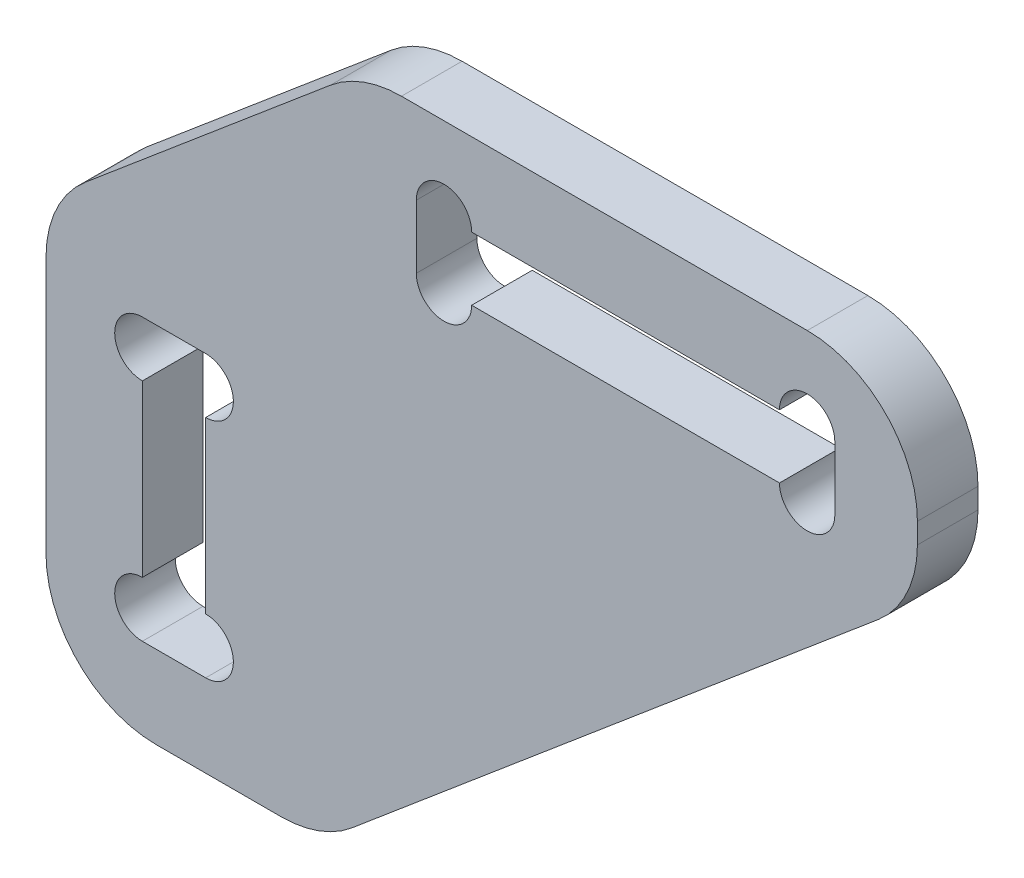
from build123d import *

# Parameters (mm, degrees)
EXTRUDE_1_DEPTH = 2.2
FILLET_1_R      = 4


with BuildPart() as part:
    # 草图1 → 凸台-拉伸1 (new body)
    with BuildSketch(Plane.XY):
        Polygon((10.6, 4.15), (-9.6, 4.15), (-21.05, -5.5), (-21.05, -20.7), (-11.05, -20.7), (10.6, -2.45349345), align=None)
        with BuildLine():
            ThreePointArc((-14.245, -16.695), (-14.539357685, -17.405642315), (-15.25, -17.7))
            Line((-15.25, -17.7), (-17.55, -17.7))
            ThreePointArc((-17.55, -17.7), (-18.555, -16.695), (-17.55, -15.69))
            Line((-17.55, -15.69), (-17.55, -9.51))
            ThreePointArc((-17.55, -9.51), (-18.555, -8.505), (-17.55, -7.5))
            Line((-17.55, -7.5), (-15.25, -7.5))
            ThreePointArc((-15.25, -7.5), (-14.539357685, -7.794357685), (-14.245, -8.505))
            ThreePointArc((-14.245, -8.505), (-14.539357685, -9.215642315), (-15.25, -9.51))
            Line((-15.25, -9.51), (-15.25, -15.69))
            ThreePointArc((-15.25, -15.69), (-14.539357685, -15.984357685), (-14.245, -16.695))
        make_face(mode=Mode.SUBTRACT)
        with BuildLine():
            Line((5.59, -1.15), (-5.59, -1.15))
            ThreePointArc((-5.59, -1.15), (-6.595, -2.155), (-7.6, -1.15))
            Line((-7.6, -1.15), (-7.6, 1.15))
            ThreePointArc((-7.6, 1.15), (-6.595, 2.155), (-5.59, 1.15))
            Line((-5.59, 1.15), (5.59, 1.15))
            ThreePointArc((5.59, 1.15), (6.595, 2.155), (7.6, 1.15))
            Line((7.6, 1.15), (7.6, -1.15))
            ThreePointArc((7.6, -1.15), (6.595, -2.155), (5.59, -1.15))
        make_face(mode=Mode.SUBTRACT)
    extrude(amount=EXTRUDE_1_DEPTH)

    # 圆角1
    fillet_1_edges = [part.edges().sort_by_distance(p)[0] for p in [
        (-9.6, 4.15, 1.1),
        (10.6, 4.15, 1.1),
        (10.6, -2.45349345, 1.1),
        (-11.05, -20.7, 1.1),
        (-21.05, -20.7, 1.1),
        (-21.05, -5.5, 1.1),
    ]]
    fillet(fillet_1_edges, radius=FILLET_1_R)


solid = part.part
